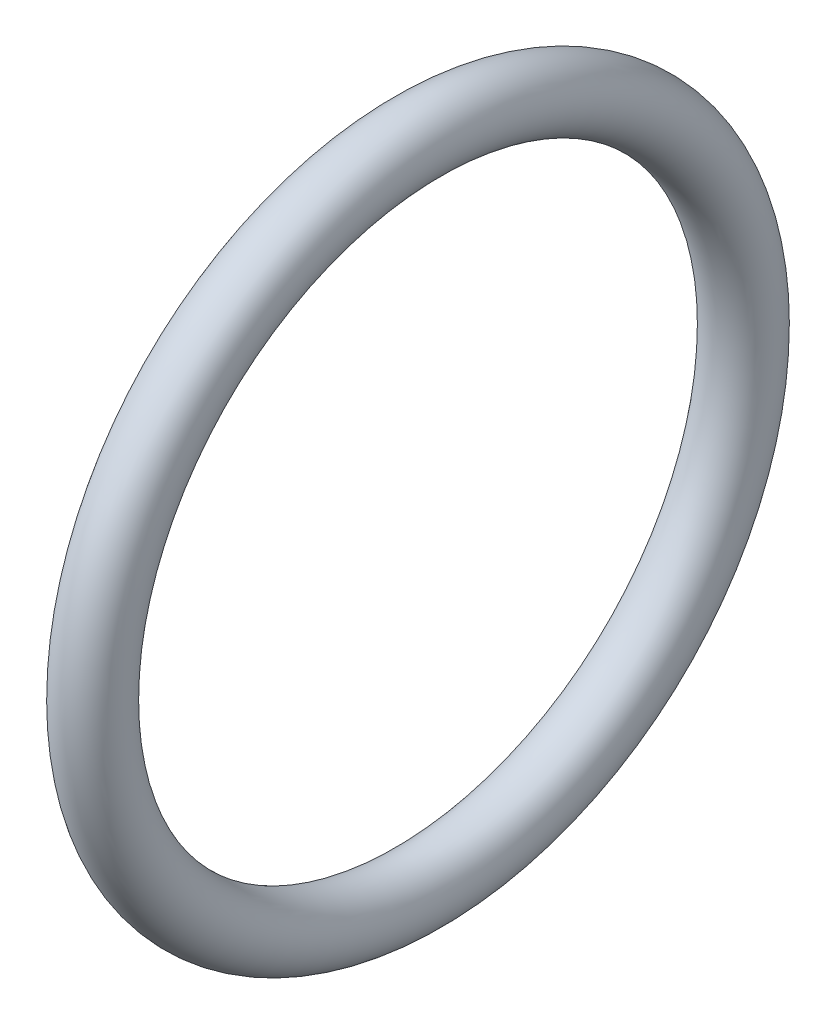
from build123d import *

# Parameters (mm, degrees)
ESBO_O1_R = 1.2


with BuildPart() as part:
    # Esboço1 → Revolução1 (revolve)
    with BuildSketch(Plane.XY):
        with Locations((0, 12)):
            Circle(ESBO_O1_R)
    revolve(axis=Axis((0, 0, 0), (1, 0, 0)))


solid = part.part
